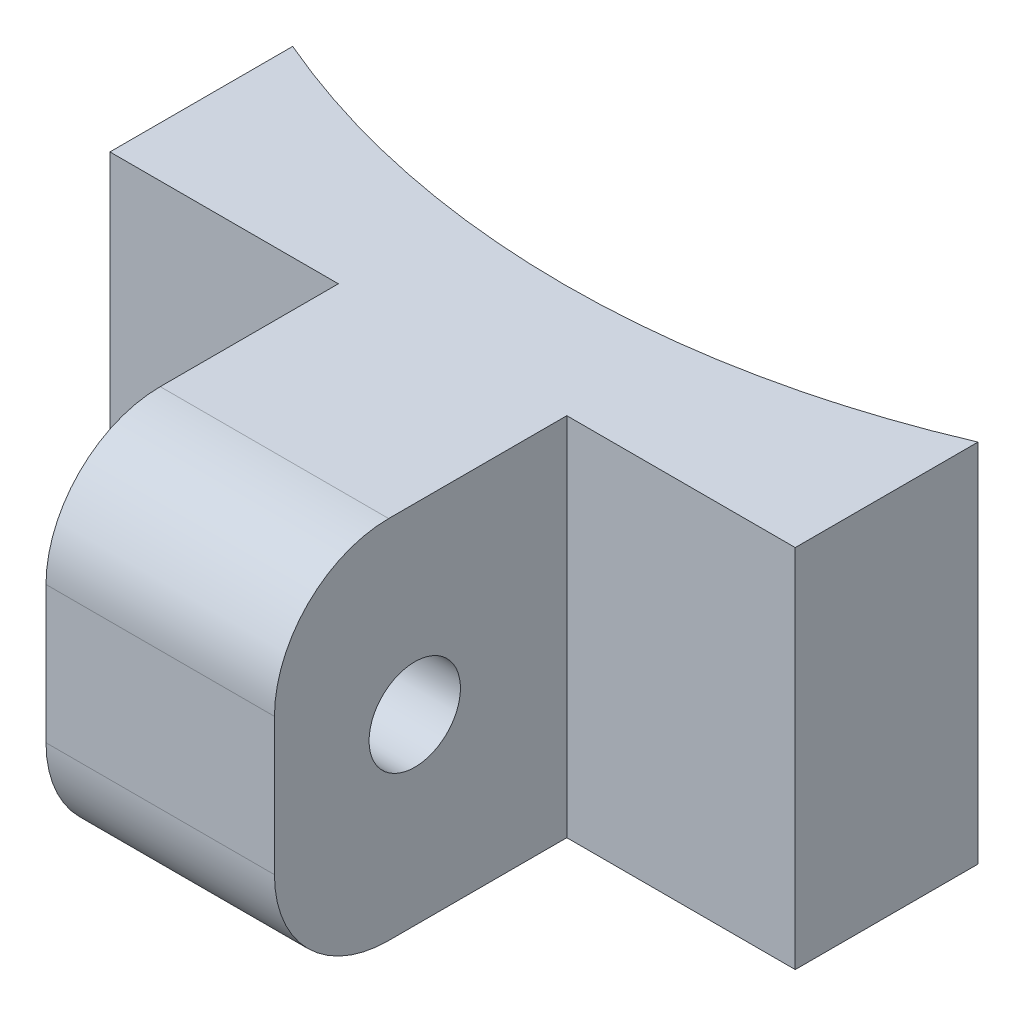
from build123d import *

# Parameters (mm, degrees)
EXTRUDE_START       = 6
EXTRUDE_1_DEPTH     = 16
EXTRUDE_2_DEPTH     = 5
SKETCH_3_R          = 2
CUT_EXTRUDE_1_DEPTH = 15


with BuildPart() as part:
    # Эскиз1 → Вытянуть1 (new body)
    with BuildSketch(Plane(origin=(0, 0, 0), x_dir=(1, 0, 0), z_dir=(0, 1, 0)).offset(EXTRUDE_START)):
        with BuildLine():
            Line((-15, -34.9141805), (-15, -42.9141805))
            Line((-15, -42.9141805), (15, -42.9141805))
            Line((15, -42.9141805), (15, -34.9141805))
            ThreePointArc((15, -34.9141805), (0, -38), (-15, -34.9141805))
        make_face()
    extrude(amount=EXTRUDE_1_DEPTH)

    # Эскиз2 → Вытянуть2 (add, symmetric)
    with BuildSketch(Plane(origin=(0, 0, 0), x_dir=(0, 0, -1), z_dir=(1, 0, 0))):
        with BuildLine():
            Line((-42.9141805, 22), (-50.712858665, 22))
            ThreePointArc((-50.712858665, 22), (-54.248392571, 20.535533906), (-55.712858665, 17))
            Line((-55.712858665, 17), (-55.712858665, 11))
            ThreePointArc((-55.712858665, 11), (-54.248392571, 7.464466094), (-50.712858665, 6))
            Line((-50.712858665, 6), (-42.9141805, 6))
            Line((-42.9141805, 6), (-42.9141805, 22))
        make_face()
    extrude(amount=EXTRUDE_2_DEPTH, both=True)

    # Эскиз3 → Вырез-Вытянуть1 (cut, symmetric)
    with BuildSketch(Plane.ZY.offset(5)):
        with Locations((49.571306652, 14)):
            Circle(SKETCH_3_R)
    extrude(amount=CUT_EXTRUDE_1_DEPTH, both=True, mode=Mode.SUBTRACT)


solid = part.part
